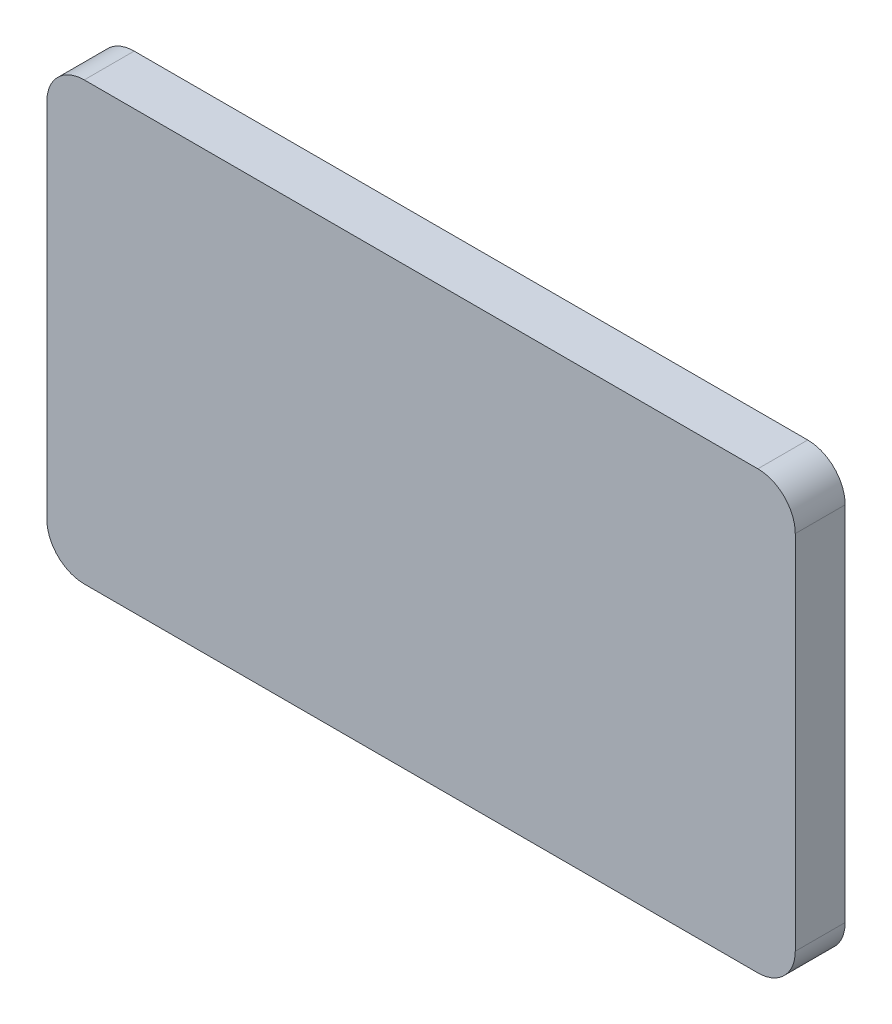
from build123d import *

# Parameters (mm, degrees)
SKETCH2_W           = 190.5
SKETCH2_H           = 111.125
BOSS_EXTRUDE1_DEPTH = 12.7
FILLET1_R           = 9.525


with BuildPart() as part:
    # Sketch2 → Boss-Extrude1 (new body)
    with BuildSketch(Plane.XY):
        with Locations((95.25, 55.5625)):
            Rectangle(SKETCH2_W, SKETCH2_H)
    extrude(amount=BOSS_EXTRUDE1_DEPTH)

    # Fillet1
    fillet1_edges = [part.edges().sort_by_distance(p)[0] for p in [
        (0, 111.125, 6.35),
        (190.5, 111.125, 6.35),
        (190.5, 0, 6.35),
        (0, 0, 6.35),
    ]]
    fillet(fillet1_edges, radius=FILLET1_R)


solid = part.part
